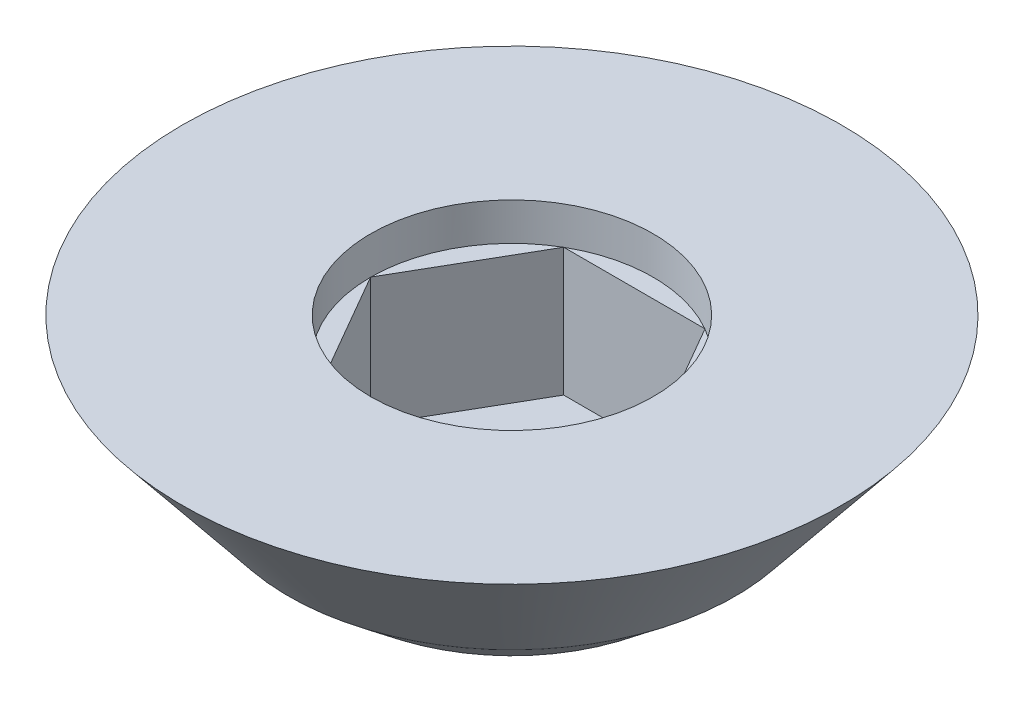
from build123d import *

# Parameters (mm, degrees)
SCHIZZO4_R               = 7.5
TAGLIO_ESTRUSIONE1_DEPTH = 2
TAGLIO_ESTRUSIONE2_DEPTH = 6.8


with BuildPart() as part:
    # Schizzo3 → Rivoluzione1 (revolve)
    with BuildSketch(Plane.XY):
        Polygon((-17.5, 9.3), (0, 9.3), (0, 0), (-9, 0), (-11.850227939, 2.294282645), align=None)
    revolve(axis=Axis((0, 9.3, 0), (0, -1, 0)))

    # Schizzo4 → Taglio-Estrusione1 (cut)
    with BuildSketch(Plane(origin=(0, 9.3, 0), x_dir=(1, 0, 0), z_dir=(0, 1, 0))):
        with Locations(Location((0, 0, 0), (0, 0, 270))):
            Circle(SCHIZZO4_R)
    extrude(amount=-TAGLIO_ESTRUSIONE1_DEPTH, mode=Mode.SUBTRACT)

    # Schizzo5 → Taglio-Estrusione2 (cut)
    with BuildSketch(Plane(origin=(0, 7.3, 0), x_dir=(1, 0, 0), z_dir=(0, 1, 0))):
        Polygon((3.75277675, -6.5), (7.505553499, 0), (3.75277675, 6.5), (-3.75277675, 6.5), (-7.505553499, 0), (-3.75277675, -6.5), align=None)
    extrude(amount=-TAGLIO_ESTRUSIONE2_DEPTH, mode=Mode.SUBTRACT)


solid = part.part
